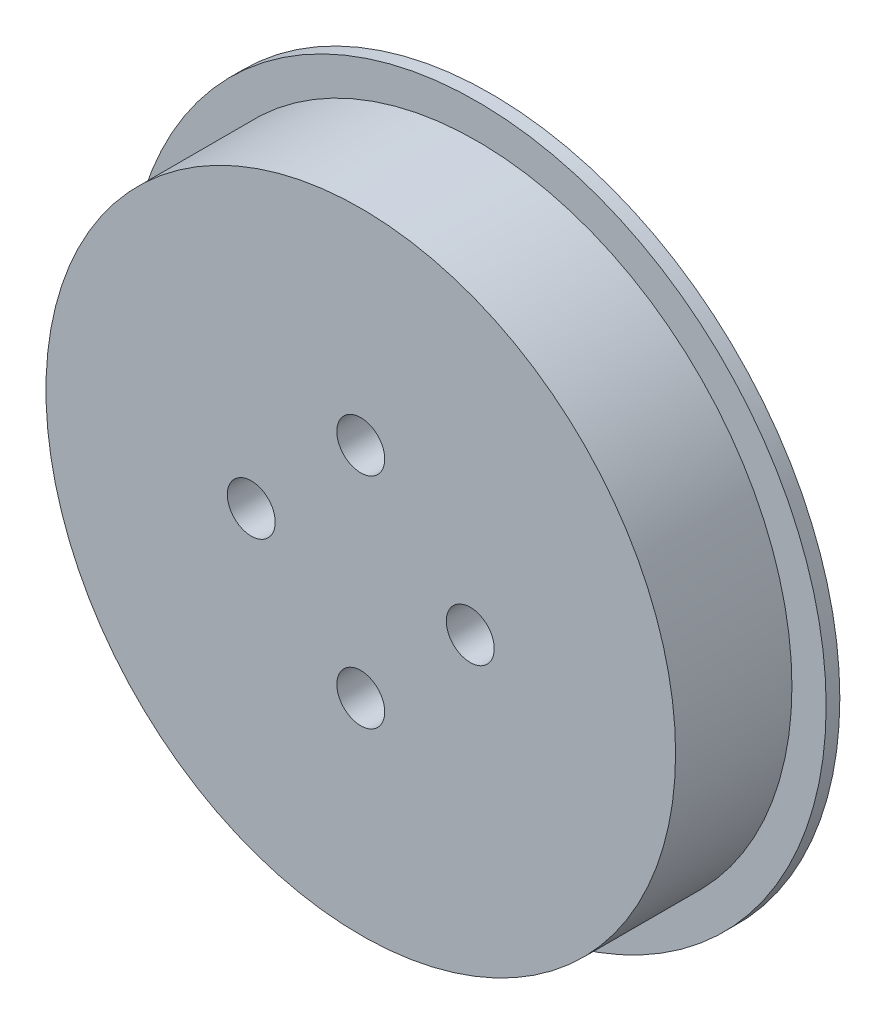
from build123d import *

# Parameters (mm, degrees)
SKETCH1_R           = 23
SKETCH1_R_2         = 1.75
BOSS_EXTRUDE1_DEPTH = 9.5
SKETCH1_3_R         = 25.5
SKETCH1_3_R_2       = 23
BOSS_EXTRUDE2_DEPTH = 1
SKETCH1_4_R         = 12.5
SKETCH1_4_R_2       = 1.75
CUT_EXTRUDE1_DEPTH  = 5


with BuildPart() as part:
    # Sketch1 → Boss-Extrude1 (new body)
    with BuildSketch(Plane.XY):
        Circle(SKETCH1_R)
        with Locations((0, 8)):
            Circle(SKETCH1_R_2, mode=Mode.SUBTRACT)
        with Locations((0, -8)):
            Circle(SKETCH1_R_2, mode=Mode.SUBTRACT)
        with Locations((8, 0)):
            Circle(SKETCH1_R_2, mode=Mode.SUBTRACT)
        with Locations((-8, 0)):
            Circle(SKETCH1_R_2, mode=Mode.SUBTRACT)
    extrude(amount=BOSS_EXTRUDE1_DEPTH)

    # Sketch1<3> → Boss-Extrude2 (add)
    with BuildSketch(Plane.XY):
        Circle(SKETCH1_3_R)
        Circle(SKETCH1_3_R_2, mode=Mode.SUBTRACT)
    extrude(amount=BOSS_EXTRUDE2_DEPTH)

    # Sketch1<4> → Cut-Extrude1 (cut)
    with BuildSketch(Plane.XY):
        Circle(SKETCH1_4_R)
        with Locations((0, -8)):
            Circle(SKETCH1_4_R_2, mode=Mode.SUBTRACT)
        with Locations((8, 0)):
            Circle(SKETCH1_4_R_2, mode=Mode.SUBTRACT)
        with Locations((-8, 0)):
            Circle(SKETCH1_4_R_2, mode=Mode.SUBTRACT)
        with Locations((0, 8)):
            Circle(SKETCH1_4_R_2, mode=Mode.SUBTRACT)
    extrude(amount=CUT_EXTRUDE1_DEPTH, mode=Mode.SUBTRACT)


solid = part.part
